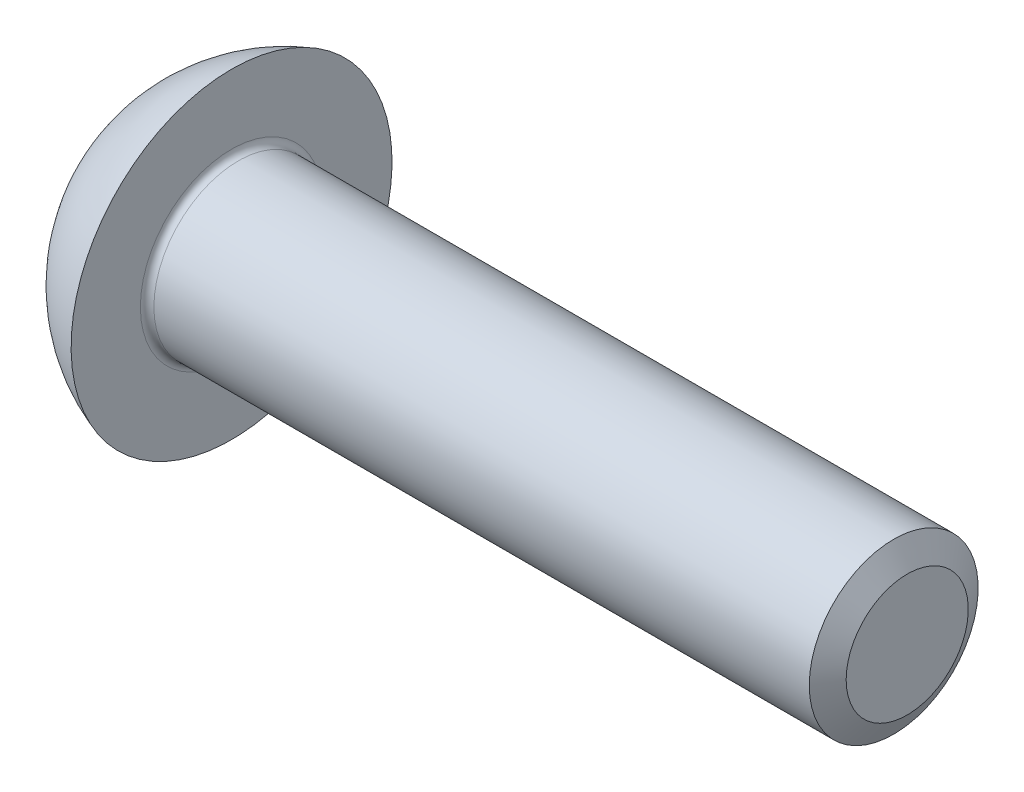
from build123d import *

# Parameters (mm, degrees)
CUT_EXTRUDE_1_DEPTH = 2.75


with BuildPart() as part:
    # 草图1 → 旋转1 (revolve)
    with BuildSketch(Plane.XY):
        with BuildLine():
            Line((0, 2.5), (-19.8, 2.5))
            ThreePointArc((-19.8, 2.5), (-19.941421356, 2.558578644), (-20, 2.7))
            Line((-20, 2.7), (-20, 4.75))
            ThreePointArc((-20, 4.75), (-21.581194586, 3.877015605), (-22.75, 2.5))
            Line((-22.75, 2.5), (-22.75, 0))
            Line((-22.75, 0), (0, 0))
            Line((0, 0), (0, 2.5))
        make_face()
    revolve(axis=Axis((-22.75, 0, 0), (1, 0, 0)))

    # 草图2 → 切除-拉伸1 (cut)
    with BuildSketch(Plane.ZY.offset(22.75)):
        Polygon((0, 1.732050808), (-1.5, 0.866025404), (-1.5, -0.866025404), (0, -1.732050808), (1.5, -0.866025404), (1.5, 0.866025404), align=None)
    extrude(amount=-CUT_EXTRUDE_1_DEPTH, mode=Mode.SUBTRACT)

    # 草图6 → 旋转2 (revolve)
    with BuildSketch(Plane.XY):
        Polygon((-21.19, 1.732050808), (-20, 0), (-19.56, 0), (-19.56, 1.732050808), align=None)
    revolve(axis=Axis((-22.75, 0, 0), (1, 0, 0)))

    # 草图7 → 切除-旋转5 (revolve, cut)
    with BuildSketch(Plane.XY):
        Polygon((-22.75, 1.732050808), (-22.31, 0), (-22.75, 0), align=None)
    revolve(axis=Axis((-22.75, 0, 0), (1, 0, 0)), mode=Mode.SUBTRACT)

    # 草图4 → 切除-旋转1 (revolve, cut)
    with BuildSketch(Plane.XY):
        Polygon((-0.4, 2.5), (0, 1.807179677), (0.4, 2.5), align=None)
    revolve(axis=Axis((-0.4, 0, 0), (1, 0, 0)), mode=Mode.SUBTRACT)


solid = part.part
